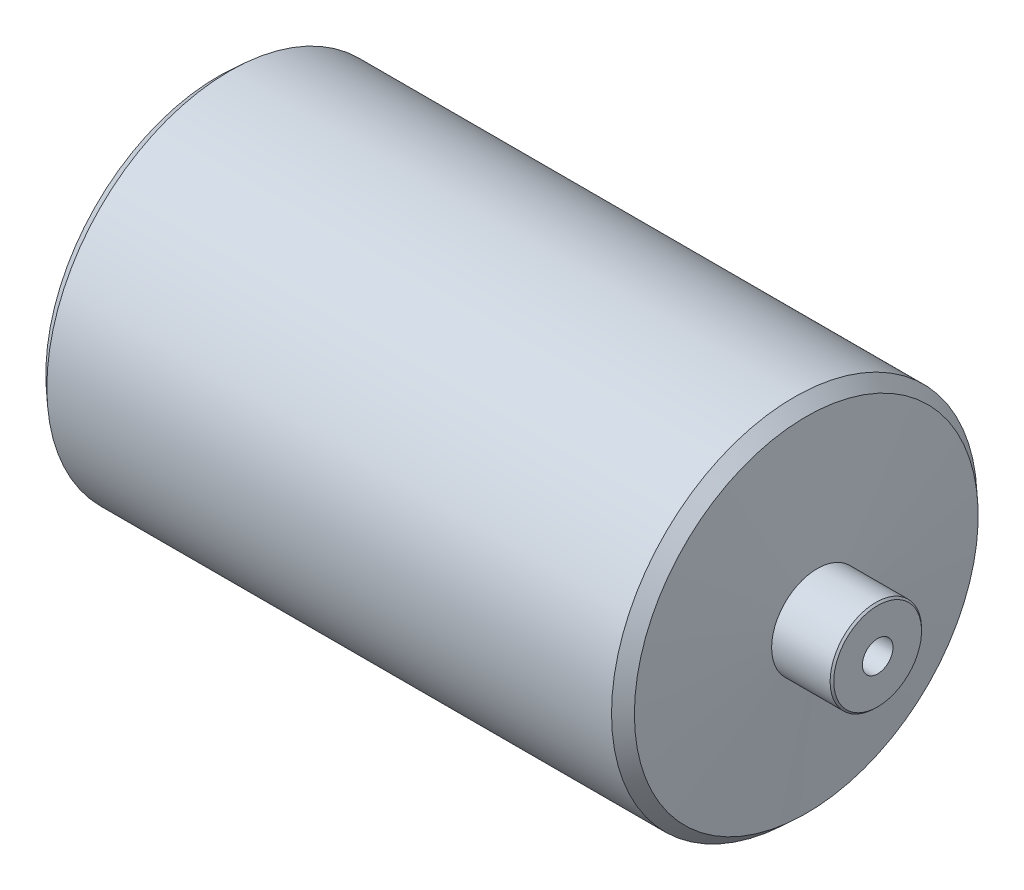
from build123d import *

# Parameters (mm, degrees)
CHAMFER_1_SIZE      = 3
CHAMFER_2_SIZE      = 0.5
HOLE_WIZARD_1_D     = 8.376
HOLE_WIZARD_1_DEPTH = 59
HOLE_WIZARD_1_TIP   = 2.516404272
HOLE_WIZARD_2_D     = 8.376
HOLE_WIZARD_2_DEPTH = 59
HOLE_WIZARD_2_TIP   = 2.516404272


with BuildPart() as part:
    # 草圖1 → 迴轉1 (revolve)
    with BuildSketch(Plane.XY, mode=Mode.PRIVATE) as revolve_1_sk:
        Polygon((0, 0), (0, 12.5), (16.5, 12.5), (19.780824882, 50), (180.219175118, 50), (183.5, 12.5), (200, 12.5), (200, 0), align=None)
    revolve(revolve_1_sk.sketch.rotate(Axis((0, 0, 0), (1, 0, 0)), 90), axis=Axis((0, 0, 0), (1, 0, 0)))

    # 倒角1
    chamfer_1_edges = [part.edges().sort_by_distance(p)[0] for p in [
        (180.219175118, 0, -50),
        (19.780824882, 0, -50),
    ]]
    chamfer(chamfer_1_edges, length=CHAMFER_1_SIZE)

    # 倒角2
    chamfer_2_edges = [part.edges().sort_by_distance(p)[0] for p in [
        (200, 0, -12.5),
        (0, 0, -12.5),
    ]]
    chamfer(chamfer_2_edges, length=CHAMFER_2_SIZE)

    # 孔1
    with Locations(Plane(origin=(200, 0, 0), x_dir=(0, 0, -1), z_dir=(1, 0, 0))):
        with Locations((0, 0)):
            Hole(HOLE_WIZARD_1_D / 2, depth=HOLE_WIZARD_1_DEPTH)
            with Locations((0, 0, -(HOLE_WIZARD_1_DEPTH + HOLE_WIZARD_1_TIP / 2))):  # 118° drill point
                Cone(0, HOLE_WIZARD_1_D / 2, HOLE_WIZARD_1_TIP, mode=Mode.SUBTRACT)

    # 孔2
    with Locations(Plane.ZY):
        with Locations((0, 0)):
            Hole(HOLE_WIZARD_2_D / 2, depth=HOLE_WIZARD_2_DEPTH)
            with Locations((0, 0, -(HOLE_WIZARD_2_DEPTH + HOLE_WIZARD_2_TIP / 2))):  # 118° drill point
                Cone(0, HOLE_WIZARD_2_D / 2, HOLE_WIZARD_2_TIP, mode=Mode.SUBTRACT)


solid = part.part
